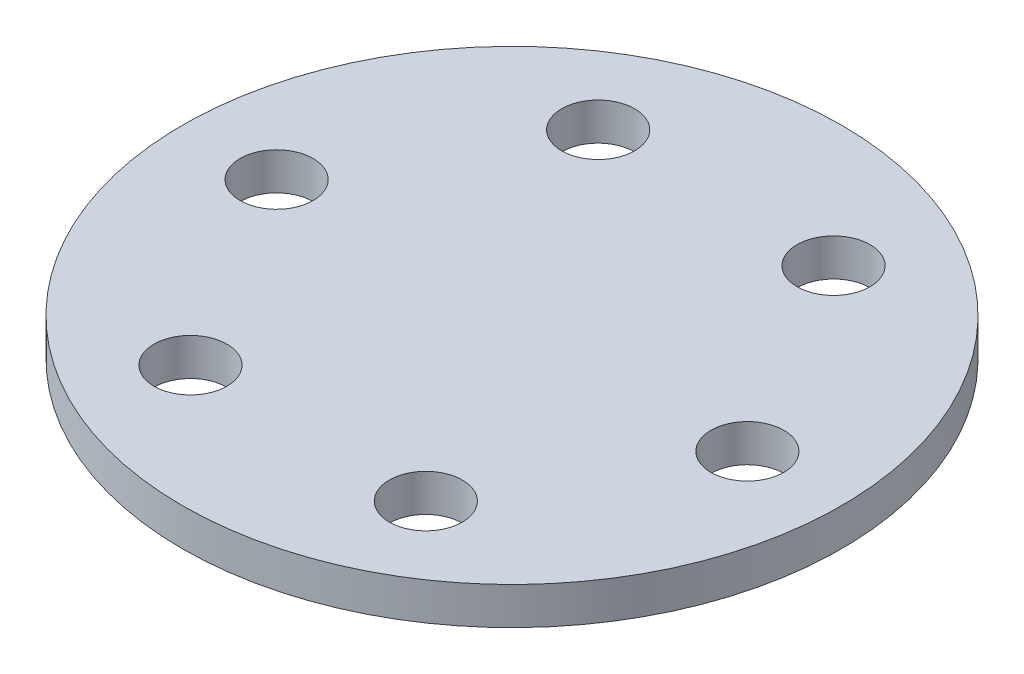
from build123d import *

# Parameters (mm, degrees)
SKETCH1_R             = 14
BOSS_EXTRUDE1_DEPTH   = 1.5875
F_3_0MM_DOWEL_HOLE1_D = 3.1


with BuildPart() as part:
    # Sketch1 → Boss-Extrude1 (new body)
    with BuildSketch(Plane(origin=(0, 0, 0), x_dir=(1, 0, 0), z_dir=(0, 1, 0))):
        with Locations(Location((0, 0, 0), (0, 0, 270))):
            Circle(SKETCH1_R)
    extrude(amount=BOSS_EXTRUDE1_DEPTH)

    # Ø3.0mm Dowel Hole1 (through all)
    with Locations(Plane(origin=(0, 1.5875, 0), x_dir=(1, 0, 0), z_dir=(0, 1, 0))):
        with Locations((-5, -8.660254038), (-10, 0), (-5, 8.660254038), (5, 8.660254038), (10, 0), (5, -8.660254038)):
            Hole(F_3_0MM_DOWEL_HOLE1_D / 2)


solid = part.part
